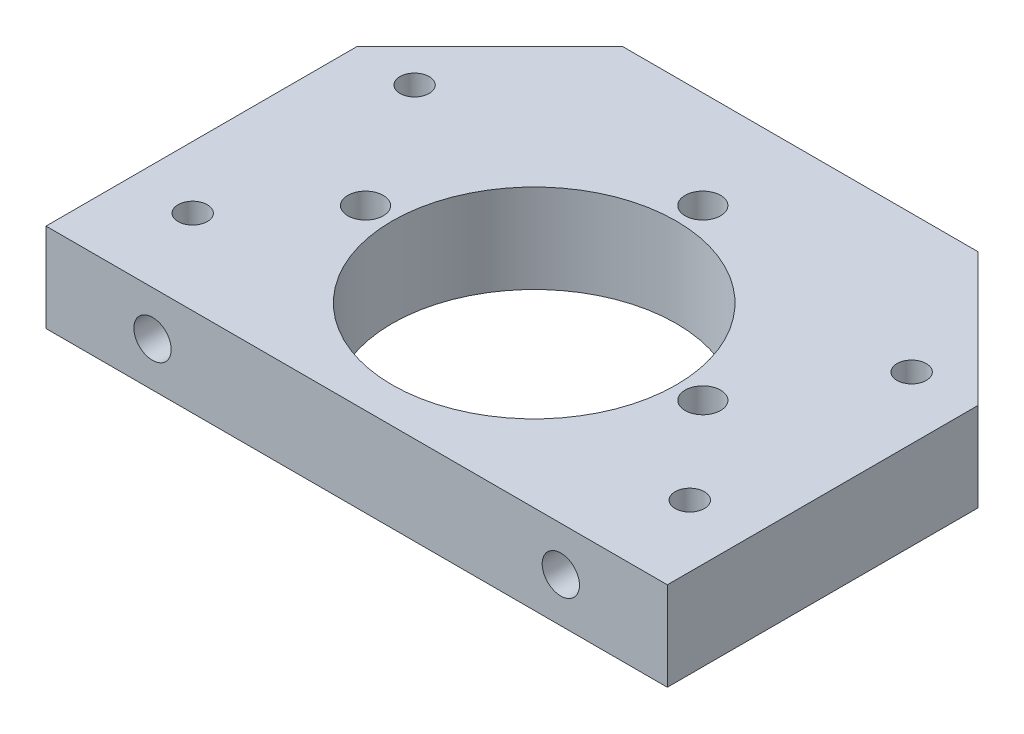
from build123d import *

# Parameters (mm, degrees)
SKETCH_1_W          = 70
SKETCH_1_H          = 50
SKETCH_1_R          = 16
EXTRUDE_1_DEPTH     = 10
CHAMFER_1_SIZE      = 15
SKETCH_4_R          = 2
CUT_EXTRUDE_3_DEPTH = 10
SKETCH_7_R          = 1.65
CUT_EXTRUDE_5_DEPTH = 10
SKETCH_8_R          = 2.1
CUT_EXTRUDE_6_DEPTH = 15


with BuildPart() as part:
    # Эскиз1 → Бобышка-Вытянуть1 (new body)
    with BuildSketch(Plane(origin=(0, 0, 0), x_dir=(1, 0, 0), z_dir=(0, 1, 0))):
        with Locations((13.122832672, -1.243812166)):
            Rectangle(SKETCH_1_W, SKETCH_1_H)
        with Locations(Location((13.122832672, -6.243812166, 0), (0, 0, 270))):
            Circle(SKETCH_1_R, mode=Mode.SUBTRACT)
    extrude(amount=EXTRUDE_1_DEPTH)

    # Фаска1
    chamfer_1_edges = [part.edges().sort_by_distance(p)[0] for p in [
        (-21.877167328, 5, -23.756187834),
        (48.122832672, 5, -23.756187834),
    ]]
    chamfer(chamfer_1_edges, length=CHAMFER_1_SIZE)

    # Эскиз4 → Вырез-Вытянуть3 (cut)
    with BuildSketch(Plane(origin=(0, 10, 0), x_dir=(1, 0, 0), z_dir=(0, 1, 0))):
        with Locations(Location((32.122832672, -6.243812166, 0), (0, 0, 270))):
            Circle(SKETCH_4_R)
        with Locations(Location((13.122832672, 12.756187834, 0), (0, 0, 270))):
            Circle(SKETCH_4_R)
        with Locations(Location((-5.877167328, -6.243812166, 0), (0, 0, 270))):
            Circle(SKETCH_4_R)
    extrude(amount=-CUT_EXTRUDE_3_DEPTH, mode=Mode.SUBTRACT)

    # Эскиз7 → Вырез-Вытянуть5 (cut)
    with BuildSketch(Plane(origin=(0, 10, 0), x_dir=(1, 0, 0), z_dir=(0, 1, 0))):
        with Locations(Location((41.122832672, 8.281187834, 0), (0, 0, 270))):
            Circle(SKETCH_7_R)
        with Locations(Location((41.122832672, -16.718812166, 0), (0, 0, 270))):
            Circle(SKETCH_7_R)
        with Locations(Location((-14.877167328, 8.281187834, 0), (0, 0, 270))):
            Circle(SKETCH_7_R)
        with Locations(Location((-14.877167328, -16.718812166, 0), (0, 0, 270))):
            Circle(SKETCH_7_R)
    extrude(amount=-CUT_EXTRUDE_5_DEPTH, mode=Mode.SUBTRACT)

    # Эскиз8 → Вырез-Вытянуть6 (cut)
    with BuildSketch(Plane.XY.offset(26.243812166)):
        with Locations((-9.877167328, 5)):
            Circle(SKETCH_8_R)
        with Locations((36.122832672, 5)):
            Circle(SKETCH_8_R)
    extrude(amount=-CUT_EXTRUDE_6_DEPTH, mode=Mode.SUBTRACT)


solid = part.part
